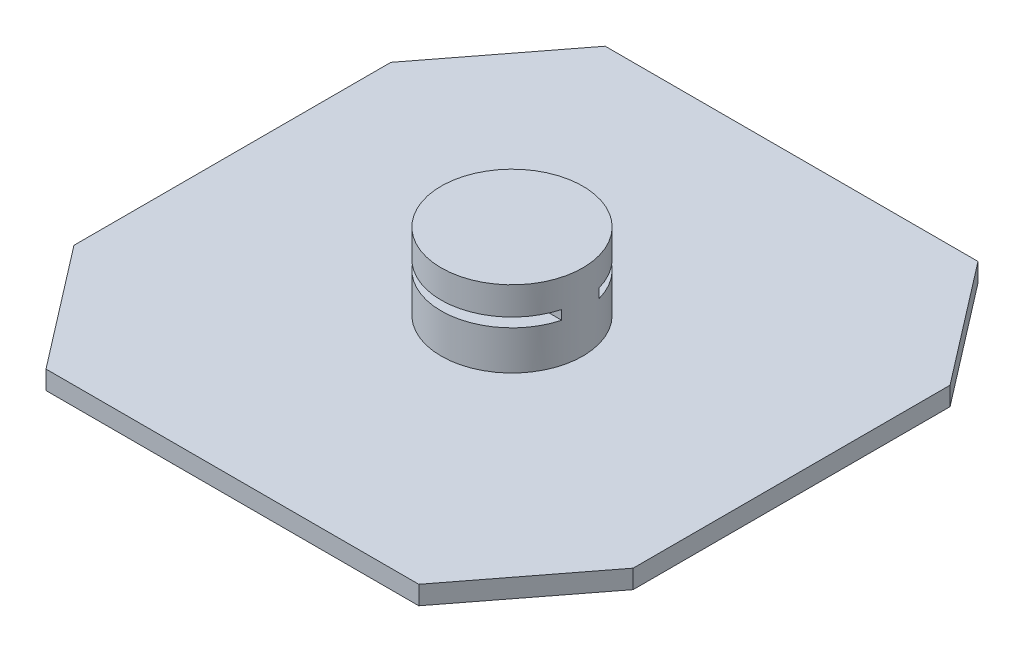
from build123d import *

# Parameters (mm, degrees)
BOSS_EXTRUDE1_DEPTH = 10
SKETCH2_R           = 38
BOSS_EXTRUDE2_DEPTH = 41
CUT_EXTRUDE1_START  = 10
SKETCH3_W           = 76
SKETCH3_H           = 5
CUT_EXTRUDE1_DEPTH  = 50
CUT_EXTRUDE2_START  = -10
SKETCH4_W           = 76
SKETCH4_H           = 5
CUT_EXTRUDE2_DEPTH  = 41


with BuildPart() as part:
    # Sketch1 → Boss-Extrude1 (new body)
    with BuildSketch(Plane(origin=(0, 0, 0), x_dir=(1, 0, 0), z_dir=(0, 1, 0))):
        Polygon((-100, 150), (-150, 85), (-150, -85), (-100, -150), (100, -150), (150, -85), (150, 85), (100, 150), align=None)
    extrude(amount=BOSS_EXTRUDE1_DEPTH)

    # Sketch2 → Boss-Extrude2 (add)
    with BuildSketch(Plane(origin=(0, 10, 0), x_dir=(1, 0, 0), z_dir=(0, 1, 0))):
        with Locations(Location((0, 0, 0), (0, 0, 270))):
            Circle(SKETCH2_R)
    extrude(amount=BOSS_EXTRUDE2_DEPTH)

    # Sketch3 → Cut-Extrude1 (cut)
    with BuildSketch(Plane.XY.offset(CUT_EXTRUDE1_START)):
        with Locations((0, 33.5)):
            Rectangle(SKETCH3_W, SKETCH3_H)
    extrude(amount=CUT_EXTRUDE1_DEPTH, mode=Mode.SUBTRACT)

    # Sketch4 → Cut-Extrude2 (cut)
    with BuildSketch(Plane.XY.offset(CUT_EXTRUDE2_START)):
        with Locations((0, 33.5)):
            Rectangle(SKETCH4_W, SKETCH4_H)
    extrude(amount=-CUT_EXTRUDE2_DEPTH, mode=Mode.SUBTRACT)


solid = part.part
